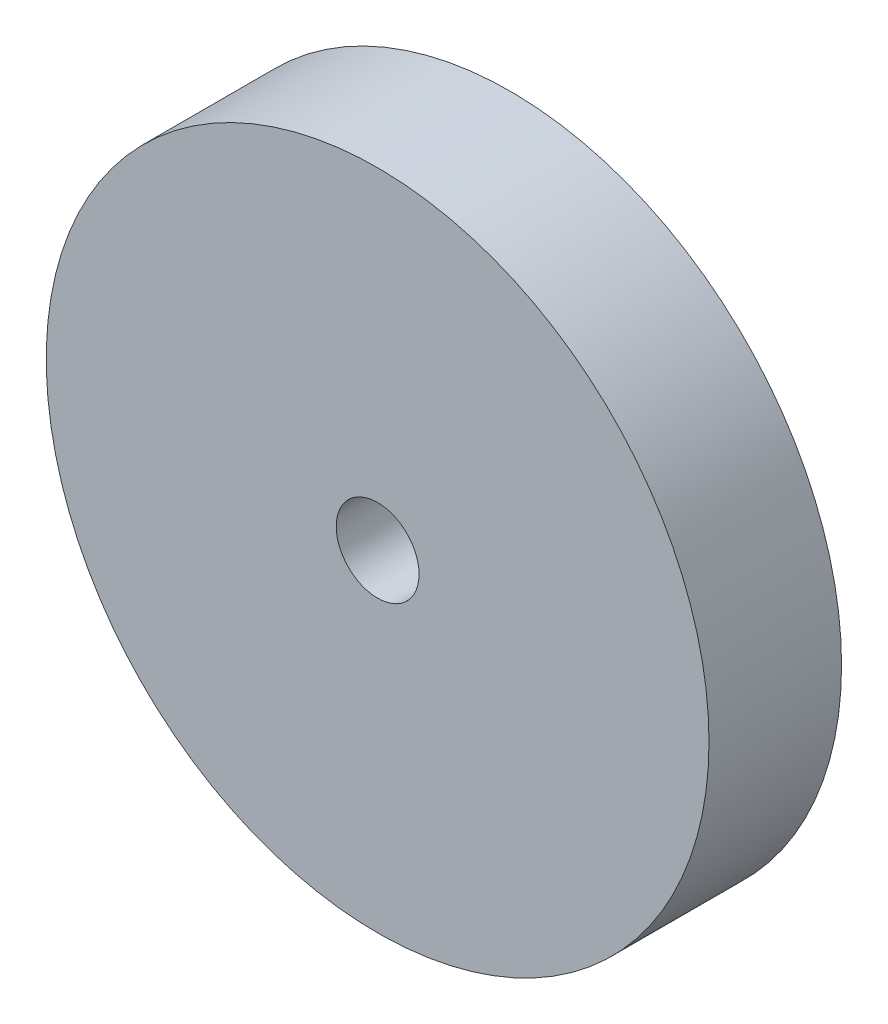
from build123d import *

# Parameters (mm, degrees)
SKETCH_1_R      = 10
SKETCH_1_R_2    = 1.25
EXTRUDE_1_DEPTH = 4


with BuildPart() as part:
    # 草圖1 → 填料-伸長1 (new body)
    with BuildSketch(Plane.XY):
        with Locations((-13.087913908, 3.342134229)):
            Circle(SKETCH_1_R)
        with Locations((-13.087913908, 3.342134229)):
            Circle(SKETCH_1_R_2, mode=Mode.SUBTRACT)
    extrude(amount=EXTRUDE_1_DEPTH)


solid = part.part
